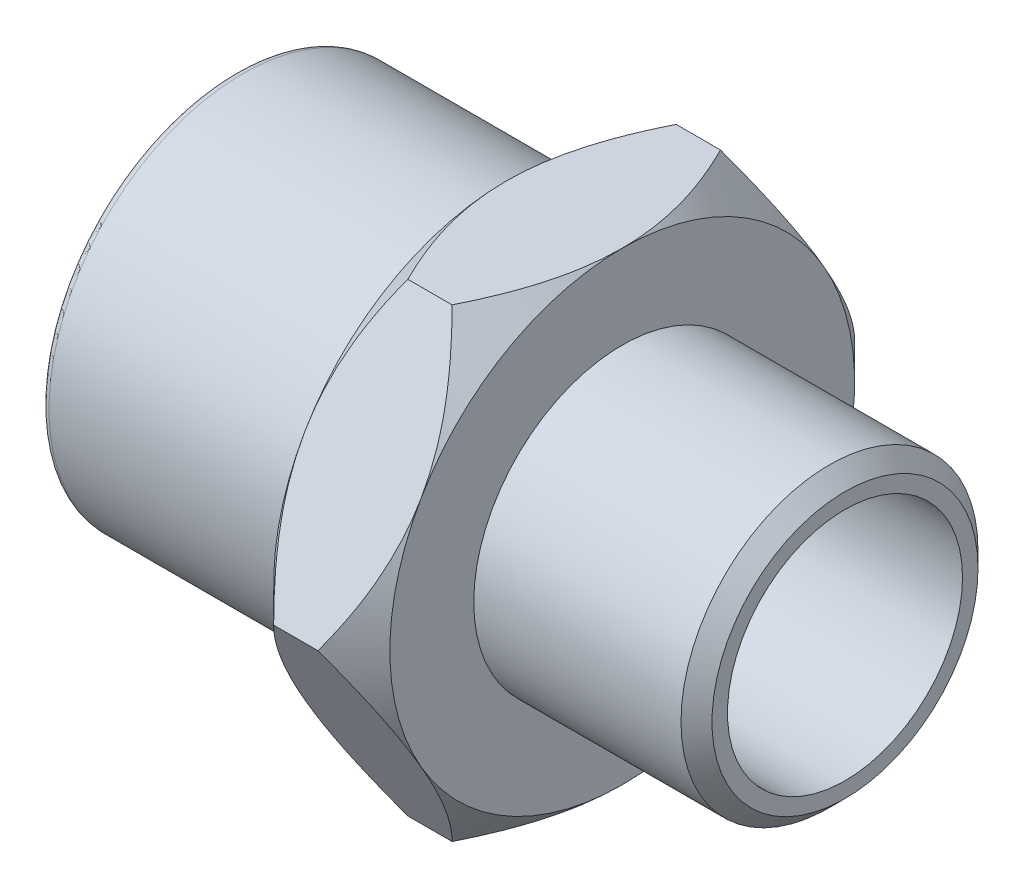
from build123d import *

# Parameters (mm, degrees)
EXTRUDE_1_DEPTH     = 7.5
SKETCH_2_OUTSIDE_W  = 85.93
SKETCH_2_OUTSIDE_H  = 81.288
SKETCH_2_OUTSIDE_R  = 15
CUT_EXTRUDE_1_DEPTH = 20
CUT_EXTRUDE_1_DRAFT = -45
SKETCH_3_OUTSIDE_W  = 85.93
SKETCH_3_OUTSIDE_H  = 81.288
SKETCH_3_OUTSIDE_R  = 15
CUT_EXTRUDE_2_DEPTH = 20
CUT_EXTRUDE_2_DRAFT = -45
SKETCH_4_R          = 12.5
EXTRUDE_2_DEPTH     = 25
SKETCH_5_R          = 10
CUT_EXTRUDE_3_DEPTH = 17.5
SKETCH_6_R          = 9.585
EXTRUDE_3_DEPTH     = 14.3775
CHAMFER_1_SIZE      = 1
FILLET_1_R          = 0.5
SKETCH_7_R          = 7.585
CUT_EXTRUDE_4_DEPTH = 21.8775


with BuildPart() as part:
    # Эскиз1 → Бобышка-Вытянуть1 (new body)
    with BuildSketch(Plane(origin=(0, 0, 0), x_dir=(0, 0, -1), z_dir=(1, 0, 0))):
        Polygon((17.320508076, 0), (8.660254038, 15), (-8.660254038, 15), (-17.320508076, 0), (-8.660254038, -15), (8.660254038, -15), align=None)
    extrude(amount=-EXTRUDE_1_DEPTH)


with BuildPart() as cut_extrude_1_tool:
    # Эскиз2 outside → Вырез-Вытянуть1 (with draft: the straight prism first)
    with BuildSketch(Plane(origin=(0, 0, 0), x_dir=(0, 0, -1), z_dir=(1, 0, 0))):
        Rectangle(SKETCH_2_OUTSIDE_W, SKETCH_2_OUTSIDE_H)
        Circle(SKETCH_2_OUTSIDE_R, mode=Mode.SUBTRACT)
    extrude(amount=-CUT_EXTRUDE_1_DEPTH)
    # Вырез-Вытянуть1: the draft: its side faces are tilted about the plane it starts from
    cut_extrude_1_sides = [cut_extrude_1_tool.faces().sort_by_distance(p)[0] for p in [
        (-10, -40.644, 0),
        (-10, 0, -42.965),
        (-10, 40.644, 0),
        (-10, 0, 42.965),
        (-10, 0, 15),
    ]]
    draft(cut_extrude_1_sides, Plane(origin=(0, 0, 0), x_dir=(0, 0, -1), z_dir=(1, 0, 0)), CUT_EXTRUDE_1_DRAFT)


with BuildPart() as part_1:
    add(part.part)

    # Вырез-Вытянуть1: cut by cut_extrude_1_tool
    add(cut_extrude_1_tool.part, mode=Mode.SUBTRACT)


with BuildPart() as cut_extrude_2_tool:
    # Эскиз3 outside → Вырез-Вытянуть2 (with draft: the straight prism first)
    with BuildSketch(Plane.ZY.offset(7.5)):
        Rectangle(SKETCH_3_OUTSIDE_W, SKETCH_3_OUTSIDE_H)
        Circle(SKETCH_3_OUTSIDE_R, mode=Mode.SUBTRACT)
    extrude(amount=-CUT_EXTRUDE_2_DEPTH)
    # Вырез-Вытянуть2: the draft: its side faces are tilted about the plane it starts from
    cut_extrude_2_sides = [cut_extrude_2_tool.faces().sort_by_distance(p)[0] for p in [
        (2.5, -40.644, 0),
        (2.5, 0, 42.965),
        (2.5, 40.644, 0),
        (2.5, 0, -42.965),
        (2.5, 0, -15),
    ]]
    draft(cut_extrude_2_sides, Plane.ZY.offset(7.5), CUT_EXTRUDE_2_DRAFT)


with BuildPart() as part_2:
    add(part_1.part)

    # Вырез-Вытянуть2: cut by cut_extrude_2_tool
    add(cut_extrude_2_tool.part, mode=Mode.SUBTRACT)

    # Эскиз4 → Бобышка-Вытянуть2 (add)
    with BuildSketch(Plane(origin=(0, 0, 0), x_dir=(0, 0, -1), z_dir=(1, 0, 0))):
        Circle(SKETCH_4_R)
    extrude(amount=-EXTRUDE_2_DEPTH)

    # Эскиз5 → Вырез-Вытянуть3 (cut)
    with BuildSketch(Plane.ZY.offset(25)):
        Circle(SKETCH_5_R)
    extrude(amount=-CUT_EXTRUDE_3_DEPTH, mode=Mode.SUBTRACT)

    # Эскиз6 → Бобышка-Вытянуть3 (add)
    with BuildSketch(Plane(origin=(0, 0, 0), x_dir=(0, 0, -1), z_dir=(1, 0, 0))):
        Circle(SKETCH_6_R)
    extrude(amount=EXTRUDE_3_DEPTH)

    # Фаска1
    chamfer_1_edges = [part_2.edges().sort_by_distance(p)[0] for p in [
        (14.3775, 0, 9.585),
    ]]
    chamfer(chamfer_1_edges, length=CHAMFER_1_SIZE)

    # Скругление1
    fillet_1_edges = [part_2.edges().sort_by_distance(p)[0] for p in [
        (-25, 0, 12.5),
        (-25, 0, -10),
    ]]
    fillet(fillet_1_edges, radius=FILLET_1_R)

    # Эскиз7 → Вырез-Вытянуть4 (cut)
    with BuildSketch(Plane(origin=(14.3775, 0, 0), x_dir=(0, 0, -1), z_dir=(1, 0, 0))):
        Circle(SKETCH_7_R)
    extrude(amount=-CUT_EXTRUDE_4_DEPTH, mode=Mode.SUBTRACT)


solid = part_2.part
